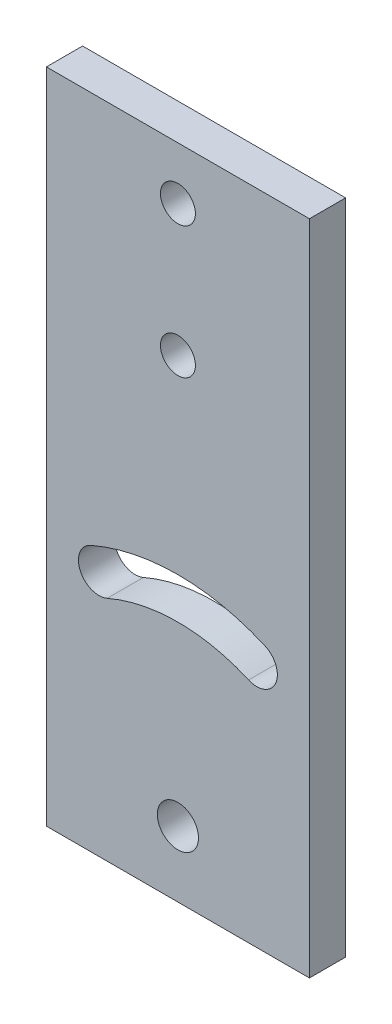
from build123d import *

# Parameters (mm, degrees)
SKETCH1_W           = 50.8
SKETCH1_H           = 127
SKETCH1_R           = 3.96875
SKETCH1_R_2         = 3.3734375
BOSS_EXTRUDE2_DEPTH = 6.985


with BuildPart() as part:
    # Sketch1 → Boss-Extrude2 (new body)
    with BuildSketch(Plane.XY):
        with Locations((25.4, 63.5)):
            Rectangle(SKETCH1_W, SKETCH1_H)
        with Locations((25.4, 12.7)):
            Circle(SKETCH1_R, mode=Mode.SUBTRACT)
        with Locations((25.4, 116.84)):
            Circle(SKETCH1_R_2, mode=Mode.SUBTRACT)
        with Locations((25.4, 91.44)):
            Circle(SKETCH1_R_2, mode=Mode.SUBTRACT)
        with BuildLine():
            ThreePointArc((42.2275, 51.256646253), (25.4, 54.76875), (8.5725, 51.256646253))
            ThreePointArc((8.5725, 51.256646253), (6.522580542, 46.031726796), (11.7475, 43.981807338))
            ThreePointArc((11.7475, 43.981807338), (25.4, 46.83125), (39.0525, 43.981807338))
            ThreePointArc((39.0525, 43.981807338), (44.277419458, 46.031726796), (42.2275, 51.256646253))
        make_face(mode=Mode.SUBTRACT)
    extrude(amount=BOSS_EXTRUDE2_DEPTH)


solid = part.part
